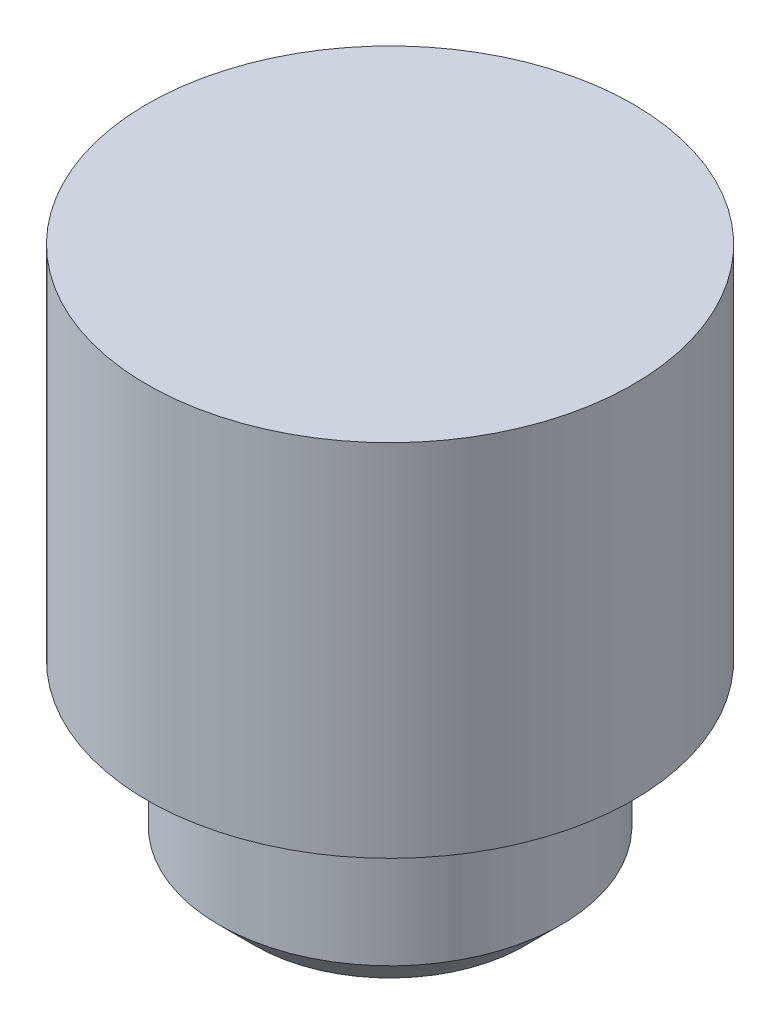
from build123d import *

# Parameters (mm, degrees)
CHAMFER1_SIZE = 1


with BuildPart() as part:
    # Sketch1 → Revolve1 (revolve)
    with BuildSketch(Plane.XY, mode=Mode.PRIVATE) as revolve1_sk:
        Polygon((0, -7.5), (0, 7.5), (6.75, 7.5), (6.75, -2.5), (4.75, -2.5), (4.75, -7.5), align=None)
    revolve(revolve1_sk.sketch.rotate(Axis((0, -27.698412698, 0), (0, 1, 0)), 90), axis=Axis((0, -27.698412698, 0), (0, 1, 0)))

    # Chamfer1
    chamfer1_edges = [part.edges().sort_by_distance(p)[0] for p in [
        (0, -7.5, 4.75),
    ]]
    chamfer(chamfer1_edges, length=CHAMFER1_SIZE)


solid = part.part
